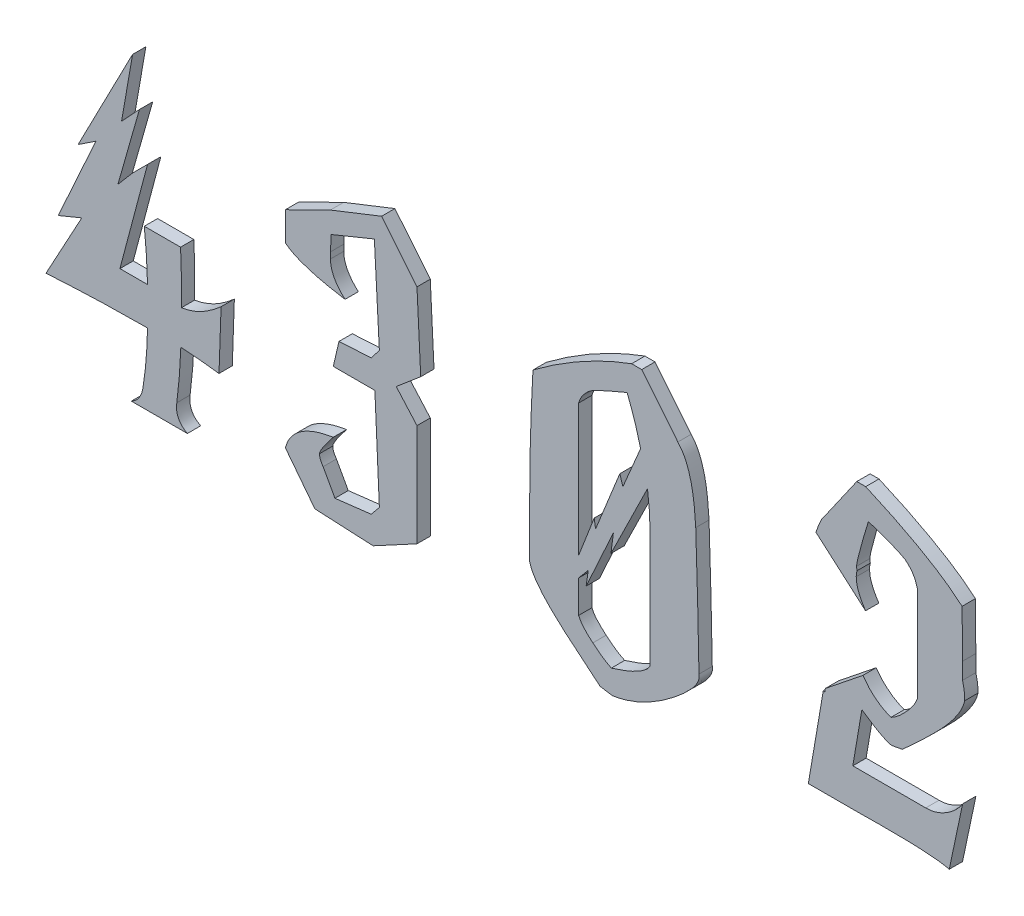
from build123d import *

# Parameters (mm, degrees)
EXTRUDE_4_DEPTH = 3.175
EXTRUDE_3_DEPTH = 3.175
EXTRUDE_0_DEPTH = 3.175
EXTRUDE_2_DEPTH = 3.175


with BuildPart() as part:
    # Sketch1 → Extrude 4 (new body)
    with BuildSketch(Plane.XY):
        with BuildLine():
            add(Edge.make_bspline(
                [(23.772094927, 0.89772007), (24.133181564, 1.117918009), (24.844645518, 1.551783125), (25.656385717, 2.531431941), (26.271170278, 3.689539697), (26.454118657, 4.565391032), (26.549416395, 5.021621644)],
                knots=[0, 0, 0, 0, 0.978141421, 1.927272551, 2.920317096, 4, 4, 4, 4], degree=3))
            add(Edge.make_bspline(
                [(26.549416395, 5.021621644), (26.692532674, 5.960425445), (26.991533243, 7.921787714), (27.306155095, 11.020182029), (27.52652261, 14.393702612), (27.603560872, 16.738430897), (27.643512731, 17.954401408)],
                knots=[0, 0, 0, 0, 0.877238001, 1.832738124, 2.876063146, 4, 4, 4, 4], degree=3))
            add(Edge.make_bspline(
                [(27.643512731, 17.954401408), (25.787225818, 17.940634521), (21.966652061, 17.91229978), (16.069678202, 17.771723769), (9.845969724, 17.51626565), (5.588300638, 17.277369594), (3.40507083, 17.154869471)],
                knots=[0, 0, 0, 0, 0.918404917, 1.890243206, 2.918167704, 4, 4, 4, 4], degree=3))
            Line((3.40507083, 17.154869471), (11.947438375, 32.864970703))
            Line((11.947438375, 32.864970703), (6.322661059, 30.53650927))
            Line((6.322661059, 30.53650927), (15.327915515, 50.412592705))
            Line((15.327915515, 50.412592705), (11.06374518, 47.579163732))
            Line((11.06374518, 47.579163732), (24.066659325, 72.715325704))
            Line((24.066659325, 72.715325704), (21.443633495, 57.594353268))
            Line((21.443633495, 57.594353268), (25.707803829, 62.153088001))
            Line((25.707803829, 62.153088001), (20.573967176, 44.114525336))
            Line((20.573967176, 44.114525336), (24.052632449, 48.182319405))
            Line((24.052632449, 48.182319405), (27.643512731, 51.773199686))
            Line((27.643512731, 51.773199686), (21.050880964, 26.931602113))
            Line((21.050880964, 26.931602113), (27.643512731, 26.931602113))
            add(Edge.make_bspline(
                [(27.643512731, 26.931602113), (27.614064995, 27.852831202), (27.553948946, 29.733473298), (27.399618607, 32.600524186), (27.175428231, 35.570309151), (26.974469272, 37.57838656), (26.872034546, 38.601963028)],
                knots=[0, 0, 0, 0, 0.94540692, 1.929999902, 2.944859706, 4, 4, 4, 4], degree=3))
            Line((26.872034546, 38.601963028), (35.526617099, 38.601963028))
            add(Edge.make_bspline(
                [(35.526617099, 38.601963028), (35.573313347, 37.676355955), (35.670440979, 35.751104413), (35.728338381, 32.753024461), (35.763879832, 29.535925396), (35.73692545, 27.319677245), (35.722993365, 26.174150803)],
                knots=[0, 0, 0, 0, 0.894545733, 1.86064433, 2.89421747, 4, 4, 4, 4], degree=3))
            add(Edge.make_bspline(
                [(35.722993365, 26.174150803), (36.117486774, 26.241093443), (36.910579514, 26.375675469), (38.086220064, 26.725901052), (39.267351569, 27.176695161), (40.456052126, 27.735084373), (41.645961202, 28.417414413), (42.828250954, 29.220152004), (44.029069132, 30.115570181), (44.797901392, 30.78383949), (45.191134733, 31.125638067)],
                knots=[0, 0, 0, 0, 0.885398122, 1.780011547, 2.710746847, 3.683444487, 4.685192361, 5.744877369, 6.846576229, 8, 8, 8, 8], degree=3))
            Line((45.191134733, 31.125638067), (44.700194069, 17.070708214))
            add(Edge.make_bspline(
                [(44.700194069, 17.070708214), (44.017767361, 17.156636182), (42.607367259, 17.334227144), (40.405604193, 17.575650376), (38.048387392, 17.783178787), (36.419860402, 17.896268323), (35.582724604, 17.954401408)],
                knots=[0, 0, 0, 0, 0.900877759, 1.861882116, 2.900911663, 4, 4, 4, 4], degree=3))
            add(Edge.make_bspline(
                [(35.582724604, 17.954401408), (35.530569672, 16.808667614), (35.43068066, 14.614316799), (35.225372143, 11.475525989), (34.962446373, 8.631603388), (34.736260417, 6.839928188), (34.628897029, 5.989476095)],
                knots=[0, 0, 0, 0, 1.146216427, 2.195275171, 3.143353656, 4, 4, 4, 4], degree=3))
            add(Edge.make_bspline(
                [(34.628897029, 5.989476095), (34.597329056, 5.709299302), (34.536357313, 5.168153774), (34.581066098, 4.373789969), (34.728823476, 3.636815597), (35.008957605, 2.965254414), (35.368271404, 2.340286822), (35.856208951, 1.786073758), (36.460511684, 1.30394899), (36.916209531, 1.036909909), (37.153734727, 0.89772007)],
                knots=[0, 0, 0, 0, 1.105116385, 2.134469392, 3.110050178, 4.04055917, 4.97864073, 5.928322711, 6.920171434, 8, 8, 8, 8], degree=3))
            Line((37.153734727, 0.89772007), (23.772094927, 0.89772007))
        make_face()
    extrude(amount=EXTRUDE_4_DEPTH)


with BuildPart() as body_2:
    # Sketch3 → Extrude 3 (new body)
    with BuildSketch(Plane.XY):
        with BuildLine():
            Line((73.339538766, 38.027874372), (81.026266869, 38.462707531))
            Line((81.026266869, 38.462707531), (82.976002647, 40.973518353))
            Line((82.976002647, 40.973518353), (81.783718178, 63.416520113))
            Line((81.783718178, 63.416520113), (71.473964244, 59.194430407))
            Line((71.473964244, 59.194430407), (71.305641731, 55.519388869))
            add(Edge.make_bspline(
                [(71.305641731, 55.519388869), (71.305641731, 55.290283226), (71.305641731, 54.799342562), (71.305641731, 54.308401899), (71.305641731, 54.046566878)],
                knots=[0, 0, 0, 0, 0.933333333, 2, 2, 2, 2], degree=3))
            add(Edge.make_bspline(
                [(71.305641731, 54.046566878), (71.315755137, 53.755722276), (71.335828828, 53.178436611), (71.519471149, 52.323588317), (71.784327305, 51.475057233), (72.162032263, 50.634574093), (72.665556424, 49.812590013), (73.269980654, 49.003836908), (73.972602227, 48.195727953), (74.508259961, 47.696949716), (74.784307004, 47.439908235)],
                knots=[0, 0, 0, 0, 0.906268931, 1.798816475, 2.716865472, 3.676613508, 4.664762582, 5.717953976, 6.823965351, 8, 8, 8, 8], degree=3))
            add(Edge.make_bspline(
                [(74.784307004, 47.439908235), (74.06869249, 47.564688688), (72.715310734, 47.800675501), (70.813558867, 48.155000768), (69.170010523, 48.523648785), (68.163270274, 48.771023082), (67.700734573, 48.884676473)],
                knots=[0, 0, 0, 0, 1.205427016, 2.279723092, 3.209637752, 4, 4, 4, 4], degree=3))
            add(Edge.make_bspline(
                [(67.700734573, 48.884676473), (66.944577369, 49.098689452), (65.520456133, 49.501754351), (63.559415325, 50.227768661), (61.895809145, 51.016961891), (60.965087998, 51.677815112), (60.533000886, 51.984616092)],
                knots=[0, 0, 0, 0, 1.19968382, 2.259444459, 3.191947426, 4, 4, 4, 4], degree=3))
            Line((60.533000886, 51.984616092), (60.533000886, 58.843758505))
            Line((60.533000886, 58.843758505), (71.291614855, 64.159944547))
            Line((71.291614855, 64.159944547), (83.509023938, 68.985189925))
            Line((83.509023938, 68.985189925), (91.953203351, 58.605301611))
            Line((91.953203351, 58.605301611), (92.850923421, 40.482577689))
            Line((92.850923421, 40.482577689), (87.001716087, 35.531090426))
            Line((87.001716087, 35.531090426), (91.953203351, 29.920339986))
            Line((91.953203351, 29.920339986), (91.953203351, 5.485521819))
            Line((91.953203351, 5.485521819), (81.517207532, -0.139255497))
            Line((81.517207532, -0.139255497), (81.124455001, -0.139255497))
            Line((81.124455001, -0.139255497), (67.588519564, 0.534034555))
            Line((67.588519564, 0.534034555), (60.533000886, 9.651504021))
            add(Edge.make_bspline(
                [(60.533000886, 9.651504021), (60.695955631, 10.164589669), (61.01857529, 11.180402475), (61.84566847, 12.562723289), (62.920140995, 13.785003132), (64.23876166, 14.863264889), (65.829862397, 15.751757827), (67.644580496, 16.529946884), (69.725825075, 17.123812844), (71.204726006, 17.393452054), (71.978931784, 17.534608389)],
                knots=[0, 0, 0, 0, 0.873749767, 1.72985973, 2.598158478, 3.512071608, 4.487047562, 5.554147324, 6.719594239, 8, 8, 8, 8], degree=3))
            add(Edge.make_bspline(
                [(71.978931784, 17.534608389), (71.721792738, 17.202643819), (71.237888411, 16.57792698), (70.556644223, 15.698766403), (70.001151779, 14.910110801), (69.527820209, 14.234474395), (69.164298797, 13.654791354), (68.908499488, 13.17214615), (68.737656193, 12.799015373), (68.698334753, 12.574631182), (68.6826159, 12.484932993)],
                knots=[0, 0, 0, 0, 1.661166945, 3.126113617, 4.399001109, 5.476398951, 6.390047324, 7.101613064, 7.640867386, 8, 8, 8, 8], degree=3))
            add(Edge.make_bspline(
                [(68.6826159, 12.484932993), (68.694295125, 12.30603467), (68.718739056, 11.931610991), (68.900119907, 11.374857284), (69.168108161, 10.800541701), (69.419901953, 10.442761945), (69.552282219, 10.254659693)],
                knots=[0, 0, 0, 0, 0.881703037, 1.845352646, 2.867196896, 4, 4, 4, 4], degree=3))
            Line((69.552282219, 10.254659693), (72.371684315, 5.12082304))
            Line((72.371684315, 5.12082304), (81.026266869, 6.144784996))
            Line((81.026266869, 6.144784996), (82.976002647, 8.515327057))
            Line((82.976002647, 8.515327057), (81.909960063, 32.178667038))
            Line((81.909960063, 32.178667038), (71.978931784, 32.178667038))
            Line((71.978931784, 32.178667038), (73.339538766, 38.027874372))
        make_face()
    extrude(amount=EXTRUDE_3_DEPTH)


with BuildPart() as body_3:
    # Sketch4 → Extrude 0 (new body)
    with BuildSketch(Plane.XY.offset(3.175)):
        with BuildLine():
            add(Edge.make_bspline(
                [(162.44001785, 15.391085439), (162.467934634, 15.170652908), (162.528775387, 14.690250816), (162.304483058, 13.919988477), (161.90228514, 13.086541276), (161.274444324, 12.181159272), (160.446827837, 11.188510276), (159.381196164, 10.130387898), (158.118022657, 8.978593633), (157.183690714, 8.209663678), (156.688998649, 7.802545469)],
                knots=[0, 0, 0, 0, 0.536020511, 1.168182272, 1.911475465, 2.789034956, 3.839717223, 5.054985358, 6.440730425, 8, 8, 8, 8], degree=3))
            add(Edge.make_bspline(
                [(156.688998649, 7.802545469), (156.053229509, 7.309850031), (154.808472586, 6.345213627), (152.900928849, 5.03812846), (151.004228294, 3.903350225), (149.131175929, 2.909755267), (147.271545982, 2.081235827), (145.419198014, 1.418285591), (143.588171213, 0.900669729), (142.355832797, 0.694180751), (141.750375602, 0.592731153)],
                knots=[0, 0, 0, 0, 1.150292428, 2.252129542, 3.305001834, 4.310128921, 5.283173871, 6.213932957, 7.122491739, 8, 8, 8, 8], degree=3))
            Line((141.750375602, 0.592731153), (138.832785374, 1.069644941))
            add(Edge.make_bspline(
                [(138.832785374, 1.069644941), (137.388364586, 2.252081253), (134.529593555, 4.592337435), (131.721684977, 6.993378501), (130.332498457, 8.181271123)],
                knots=[0, 0, 0, 0, 1.010518696, 2, 2, 2, 2], degree=3))
            add(Edge.make_bspline(
                [(130.332498457, 8.181271123), (129.743522798, 8.700045524), (128.618473022, 9.690998231), (127.080292012, 11.184840901), (125.718542475, 12.566494016), (124.581375507, 13.883931993), (123.64501155, 15.119808144), (122.917042036, 16.26981655), (122.347285641, 17.323618254), (122.139610046, 18.033316821), (122.042614681, 18.364783172)],
                knots=[0, 0, 0, 0, 1.41717477, 2.707059511, 3.871476949, 4.919222323, 5.848039808, 6.667914506, 7.377846401, 8, 8, 8, 8], degree=3))
            add(Edge.make_bspline(
                [(122.042614681, 18.364783172), (122.042614681, 20.623110224), (122.042614681, 25.237952461), (122.042614681, 29.852794698), (122.042614681, 32.209309883)],
                knots=[0, 0, 0, 0, 0.978723404, 2, 2, 2, 2], degree=3))
            add(Edge.make_bspline(
                [(122.042614681, 32.209309883), (122.048435285, 34.294752412), (122.060260782, 38.53166601), (122.23320926, 44.988849534), (122.459975193, 51.648030254), (122.694894377, 56.153488936), (122.814092867, 58.439568191)],
                knots=[0, 0, 0, 0, 0.953504888, 1.937199309, 2.953330571, 4, 4, 4, 4], degree=3))
            add(Edge.make_bspline(
                [(122.814092867, 58.439568191), (123.758323238, 59.138448347), (125.633472146, 60.526355791), (128.514100985, 62.472846931), (131.418144744, 64.299344466), (134.351332965, 65.998533932), (137.310004757, 67.567290768), (140.291937371, 69.019399499), (143.304580254, 70.342040725), (145.347330572, 71.123314042), (146.365217839, 71.512616717)],
                knots=[0, 0, 0, 0, 1.042893008, 2.071083229, 3.08580193, 4.088330015, 5.07999563, 6.058435412, 7.032532827, 8, 8, 8, 8], degree=3))
            Line((146.365217839, 71.512616717), (148.777840529, 71.512616717))
            Line((148.777840529, 71.512616717), (157.40436933, 60.85219088))
            add(Edge.make_bspline(
                [(157.40436933, 60.85219088), (157.70661294, 60.505798171), (158.344462958, 59.774776609), (159.096462544, 58.421697172), (159.787344776, 56.851810441), (160.349140676, 55.016859661), (160.843287773, 52.943185478), (161.202127041, 50.610258477), (161.506035088, 48.032933366), (161.612690483, 46.227669396), (161.668539665, 45.282358409)],
                knots=[0, 0, 0, 0, 0.669757525, 1.413445431, 2.248236945, 3.172544505, 4.211049271, 5.359488866, 6.617319003, 8, 8, 8, 8], degree=3))
            add(Edge.make_bspline(
                [(161.668539665, 45.282358409), (161.684226818, 45.011238416), (161.718289194, 44.422540686), (161.735416139, 43.467933115), (161.785566662, 42.369619006), (161.824175682, 41.130442124), (161.866937805, 39.751154724), (161.90991406, 38.23626833), (161.945950435, 36.580802001), (162.013174622, 34.785915481), (162.043759873, 32.84499019), (162.105512214, 30.764602627), (162.165571914, 28.543848167), (162.197508587, 26.186926344), (162.262152109, 23.685741892), (162.309775498, 21.043717731), (162.390616337, 18.262173183), (162.423283207, 16.363659495), (162.44001785, 15.391085439)],
                knots=[0, 0, 0, 0, 0.43590383, 0.946501924, 1.532367666, 2.200740989, 2.936629437, 3.747541493, 4.633482559, 5.594661923, 6.630672521, 7.74940236, 8.935659204, 10.196792606, 11.533117766, 12.951984349, 14.438556981, 16, 16, 16, 16], degree=3))
        make_face()
        with BuildLine():
            Line((133.712975597, 25.560570612), (137.44412464, 35.154953864))
            Line((137.44412464, 35.154953864), (137.752715914, 33.022868697))
            Line((137.752715914, 33.022868697), (143.545815743, 47.372362948))
            Line((143.545815743, 47.372362948), (144.275213301, 45.043901515))
            Line((144.275213301, 45.043901515), (148.511329883, 55.031037299))
            add(Edge.make_bspline(
                [(148.511329883, 55.031037299), (148.065480436, 56.728975479), (147.175591108, 60.117960435), (145.914441118, 63.386984689), (145.28514838, 65.018173082)],
                knots=[0, 0, 0, 0, 1.002033471, 2, 2, 2, 2], degree=3))
            add(Edge.make_bspline(
                [(145.28514838, 65.018173082), (144.756151399, 64.799958317), (143.605673166, 64.325378412), (141.756123833, 63.520842467), (139.637803103, 62.586999087), (138.148818297, 61.893102853), (137.359963383, 61.525480933)],
                knots=[0, 0, 0, 0, 0.792782376, 1.72416649, 2.794277524, 4, 4, 4, 4], degree=3))
            add(Edge.make_bspline(
                [(137.359963383, 61.525480933), (136.916460127, 61.233126154), (136.062999057, 60.670529557), (135.029251108, 59.581400498), (134.189553476, 58.403184694), (133.871283569, 57.509469655), (133.712975597, 57.064934333)],
                knots=[0, 0, 0, 0, 1.078686115, 2.075783195, 3.042891413, 4, 4, 4, 4], degree=3))
            Line((133.712975597, 57.064934333), (133.712975597, 25.560570612))
        make_face(mode=Mode.SUBTRACT)
        with BuildLine():
            Line((141.427757452, 29.824740946), (142.016886248, 34.383475679))
            Line((142.016886248, 34.383475679), (135.522442614, 20.132169561))
            Line((135.522442614, 20.132169561), (135.999356401, 23.62486171))
            Line((135.999356401, 23.62486171), (133.712975597, 20.903647746))
            Line((133.712975597, 20.903647746), (133.712975597, 13.160812139))
            add(Edge.make_bspline(
                [(133.712975597, 13.160812139), (133.852878009, 12.865092674), (134.163219367, 12.20910698), (134.91567848, 11.264107045), (135.901411842, 10.223506521), (136.684475085, 9.544157992), (137.107479613, 9.177179327)],
                knots=[0, 0, 0, 0, 0.741645456, 1.645170056, 2.727939614, 4, 4, 4, 4], degree=3))
            add(Edge.make_bspline(
                [(137.107479613, 9.177179327), (137.505856866, 8.845099765), (138.264250873, 8.212917209), (139.403350646, 7.385729266), (140.467928269, 6.693910096), (141.185792558, 6.342120111), (141.525945585, 6.175427841)],
                knots=[0, 0, 0, 0, 1.161316823, 2.210808259, 3.152208859, 4, 4, 4, 4], degree=3))
            add(Edge.make_bspline(
                [(141.525945585, 6.175427841), (142.135651505, 6.366338327), (143.301665811, 6.731439519), (144.936454102, 7.338105316), (146.394081026, 7.927663022), (147.641786462, 8.567096775), (148.71844875, 9.18646772), (149.594814905, 9.832773655), (150.295565194, 10.485325001), (150.618772012, 10.98009799), (150.769656935, 11.211076361)],
                knots=[0, 0, 0, 0, 1.430278783, 2.735294949, 3.903832026, 4.947933143, 5.872617419, 6.680859509, 7.384176323, 8, 8, 8, 8], degree=3))
            Line((150.769656935, 11.211076361), (150.769656935, 39.334962942))
            add(Edge.make_bspline(
                [(150.769656935, 39.334962942), (150.75953897, 39.919545539), (150.738154454, 41.155072289), (150.621222077, 43.110817231), (150.420259403, 45.270905191), (150.244519758, 46.778907919), (150.152474387, 47.568739213)],
                knots=[0, 0, 0, 0, 0.849190235, 1.79478017, 2.844994376, 4, 4, 4, 4], degree=3))
            Line((150.152474387, 47.568739213), (141.427757452, 29.824740946))
        make_face(mode=Mode.SUBTRACT)
    extrude(amount=EXTRUDE_0_DEPTH)


with BuildPart() as body_4:
    # Sketch5 → Extrude 2 (new body)
    with BuildSketch(Plane.XY):
        with BuildLine():
            add(Edge.make_bspline(
                [(222.693070195, 38.4223876), (222.608483172, 38.082840845), (222.428026431, 37.358456671), (221.945741784, 36.266086592), (221.291958206, 35.096633363), (220.455443236, 33.852947043), (219.456737243, 32.516202492), (218.271636342, 31.1024956), (216.914387725, 29.600764476), (215.918033288, 28.603823875), (215.399094623, 28.084579914)],
                knots=[0, 0, 0, 0, 0.655156712, 1.39770193, 2.229684731, 3.165872597, 4.205691712, 5.35743354, 6.623652527, 8, 8, 8, 8], degree=3))
            add(Edge.make_bspline(
                [(215.399094623, 28.084579914), (214.886170855, 27.573526667), (213.789948306, 26.481301802), (212.014016749, 24.772939942), (209.984698627, 22.912901243), (208.558970245, 21.613155777), (207.810554652, 20.930873103)],
                knots=[0, 0, 0, 0, 0.83303225, 1.780359566, 2.834831703, 4, 4, 4, 4], degree=3))
            Line((207.810554652, 20.930873103), (205.243636326, 20.453959315))
            add(Edge.make_bspline(
                [(205.243636326, 20.453959315), (205.060130222, 20.491795202), (204.657655487, 20.574778755), (204.016190205, 20.814615344), (203.283079768, 21.156274909), (202.434642902, 21.575025355), (201.49778832, 22.108333517), (200.478778787, 22.7677685), (199.334515893, 23.487235221), (198.555330619, 24.027537875), (198.146037019, 24.311350243)],
                knots=[0, 0, 0, 0, 0.552906732, 1.212662604, 2.016373689, 2.943047478, 4.007087089, 5.199023188, 6.528691545, 8, 8, 8, 8], degree=3))
            Line((198.146037019, 24.311350243), (195.9858981, 11.617027372))
            Line((195.9858981, 11.617027372), (213.39325134, 11.617027372))
            add(Edge.make_bspline(
                [(213.39325134, 11.617027372), (213.825212513, 11.635540981), (214.689844654, 11.672598619), (215.973555086, 11.989245537), (217.241522749, 12.476982746), (218.454888025, 13.173735441), (219.609171918, 13.962297714), (220.609650252, 14.872223928), (221.511699469, 15.806311424), (221.973895353, 16.513745335), (222.202129531, 16.863079034)],
                knots=[0, 0, 0, 0, 0.97135115, 1.944298419, 2.960920088, 4.021298721, 5.087306615, 6.101472343, 7.06249944, 8, 8, 8, 8], degree=3))
            Line((222.202129531, 16.863079034), (219.00400178, 1.742106597))
            add(Edge.make_bspline(
                [(219.00400178, 1.742106597), (218.756732576, 1.8008134), (218.2184587, 1.928610706), (217.337049848, 2.075278932), (216.322120382, 2.215424556), (215.176582236, 2.34290959), (213.898861578, 2.434710017), (212.491444022, 2.519823456), (210.948283259, 2.589286913), (209.872552996, 2.622501348), (209.311430395, 2.639826668)],
                knots=[0, 0, 0, 0, 0.625417465, 1.361454955, 2.198058472, 3.14746529, 4.197879969, 5.350851563, 6.618150746, 8, 8, 8, 8], degree=3))
            add(Edge.make_bspline(
                [(209.311430395, 2.639826668), (208.652178432, 2.649796011), (207.375798787, 2.669097685), (205.519526399, 2.687058186), (203.784803091, 2.673792168), (202.17174277, 2.706700707), (200.680264888, 2.675160019), (199.310238477, 2.686292195), (198.061703994, 2.67186118), (197.271673211, 2.650119798), (196.897645046, 2.639826668)],
                knots=[0, 0, 0, 0, 1.274621455, 2.467798309, 3.588629251, 4.62814886, 5.586321172, 6.472139175, 7.276657324, 8, 8, 8, 8], degree=3))
            Line((196.897645046, 2.639826668), (185.367552892, 2.639826668))
            Line((185.367552892, 2.639826668), (188.944406297, 23.652087066))
            Line((188.944406297, 23.652087066), (189.323131952, 23.553898933))
            Line((189.323131952, 23.553898933), (189.421320085, 24.325377119))
            Line((189.421320085, 24.325377119), (198.384493913, 31.507137682))
            add(Edge.make_bspline(
                [(198.384493913, 31.507137682), (198.833201064, 30.905817617), (199.712384264, 29.727609293), (201.34196521, 28.265099947), (203.104035499, 27.023232684), (204.41823516, 26.459021343), (205.075313813, 26.176924764)],
                knots=[0, 0, 0, 0, 1.034855686, 2.027664888, 3.013864228, 4, 4, 4, 4], degree=3))
            add(Edge.make_bspline(
                [(205.075313813, 26.176924764), (205.369491652, 26.343350354), (206.001035635, 26.700634505), (206.915743319, 27.417000029), (207.888950482, 28.290108169), (208.856681212, 29.309251385), (209.762646668, 30.367771986), (210.513290812, 31.387994883), (211.074321463, 32.332644566), (211.297871476, 32.966740944), (211.401434934, 33.260497195)],
                knots=[0, 0, 0, 0, 0.838284028, 1.799636691, 2.876654207, 4.083745417, 5.28641739, 6.33380196, 7.228104581, 8, 8, 8, 8], degree=3))
            Line((211.401434934, 33.260497195), (211.401434934, 55.941955849))
            add(Edge.make_bspline(
                [(211.401434934, 55.941955849), (211.270947695, 56.396031282), (211.015507791, 57.284922682), (210.387121958, 58.520296795), (209.53102314, 59.599617545), (208.835573676, 60.198035866), (208.483844705, 60.500690582)],
                knots=[0, 0, 0, 0, 1.025738523, 2.00797067, 2.992515687, 4, 4, 4, 4], degree=3))
            add(Edge.make_bspline(
                [(208.483844705, 60.500690582), (208.186554613, 60.668043365), (207.5428447, 61.030405409), (206.455876148, 61.532866329), (205.175127791, 62.027772309), (204.257775319, 62.358843889), (203.770814335, 62.534587616)],
                knots=[0, 0, 0, 0, 0.796057552, 1.723670417, 2.791649093, 4, 4, 4, 4], degree=3))
            Line((203.770814335, 62.534587616), (199.717047142, 63.993382731))
            add(Edge.make_bspline(
                [(199.717047142, 63.993382731), (199.497259721, 63.273358705), (199.082267672, 61.913843937), (198.496209113, 59.991942399), (198.0336244, 58.29715343), (197.613569886, 56.849438702), (197.301616848, 55.638114334), (197.09894016, 54.657629896), (196.934239327, 53.922556433), (196.908121438, 53.501750366), (196.897645046, 53.332956895)],
                knots=[0, 0, 0, 0, 1.636478143, 3.089919396, 4.36735241, 5.454913271, 6.366986432, 7.08466002, 7.63283939, 8, 8, 8, 8], degree=3))
            add(Edge.make_bspline(
                [(196.897645046, 53.332956895), (196.902813532, 53.178187259), (196.912736728, 52.881038425), (196.968915201, 52.589131319), (196.995833179, 52.4492637)],
                knots=[0, 0, 0, 0, 1.041697746, 2, 2, 2, 2], degree=3))
            add(Edge.make_bspline(
                [(196.995833179, 52.4492637), (196.942085766, 52.225849342), (196.835538303, 51.782958576), (196.811412539, 51.328093782), (196.799456914, 51.102683595)],
                knots=[0, 0, 0, 0, 1.008891473, 2, 2, 2, 2], degree=3))
            add(Edge.make_bspline(
                [(196.799456914, 51.102683595), (196.829202613, 50.650921575), (196.892010247, 49.697032329), (197.351283923, 48.249452688), (198.044335655, 46.709103065), (198.687687237, 45.71295298), (199.029730213, 45.18334188)],
                knots=[0, 0, 0, 0, 0.844763695, 1.783706841, 2.821690148, 4, 4, 4, 4], degree=3))
            Line((199.029730213, 45.18334188), (187.205073661, 55.479068938))
            add(Edge.make_bspline(
                [(187.205073661, 55.479068938), (187.349133054, 55.964407324), (187.622088513, 56.883998608), (188.165120762, 58.12992779), (188.724666138, 59.211894281), (189.197112018, 59.810046706), (189.421320085, 60.093911175)],
                knots=[0, 0, 0, 0, 1.176881494, 2.229887423, 3.159959828, 4, 4, 4, 4], degree=3))
            Line((189.421320085, 60.093911175), (196.939725675, 70.86655202))
            Line((196.939725675, 70.86655202), (199.057783966, 70.86655202))
            add(Edge.make_bspline(
                [(199.057783966, 70.86655202), (200.31873336, 70.312525585), (202.770674273, 69.23521028), (206.285889518, 67.551113521), (209.546883169, 65.882700631), (212.550882661, 64.22832748), (215.309827548, 62.593440991), (217.803819523, 60.948409671), (220.065418223, 59.338546748), (221.423642298, 58.190514868), (222.075887646, 57.639207857)],
                knots=[0, 0, 0, 0, 1.240635499, 2.412440143, 3.510657947, 4.539957605, 5.501396371, 6.398578629, 7.230966627, 8, 8, 8, 8], degree=3))
            add(Edge.make_bspline(
                [(222.075887646, 57.639207857), (222.086543633, 57.382082138), (222.110367015, 56.807231152), (222.11743015, 55.853087988), (222.133578675, 54.716969468), (222.146905071, 53.39842001), (222.160152863, 51.89287043), (222.178397965, 50.204999714), (222.172814666, 48.33003283), (222.173641625, 47.020860955), (222.174075779, 46.33354572)],
                knots=[0, 0, 0, 0, 0.546223144, 1.221180492, 2.025148143, 2.958129335, 4.020126126, 5.221064335, 6.541058776, 8, 8, 8, 8], degree=3))
            add(Edge.make_bspline(
                [(222.174075779, 46.33354572), (222.174075779, 46.109115703), (222.174075779, 45.590121287), (222.174075779, 44.706428093), (222.174075779, 43.612331757), (222.174075779, 42.812799819), (222.174075779, 42.37796666)],
                knots=[0, 0, 0, 0, 0.680851064, 1.574468085, 2.680851064, 4, 4, 4, 4], degree=3))
            add(Edge.make_bspline(
                [(222.174075779, 42.37796666), (222.268753936, 41.995758946), (222.447755477, 41.273144861), (222.613304882, 40.226872331), (222.709390291, 39.289175759), (222.69826745, 38.698422685), (222.693070195, 38.4223876)],
                knots=[0, 0, 0, 0, 1.179682022, 2.230344424, 3.173111322, 4, 4, 4, 4], degree=3))
        make_face()
    extrude(amount=EXTRUDE_2_DEPTH)


solid = Compound([part.part, body_2.part, body_3.part, body_4.part])
